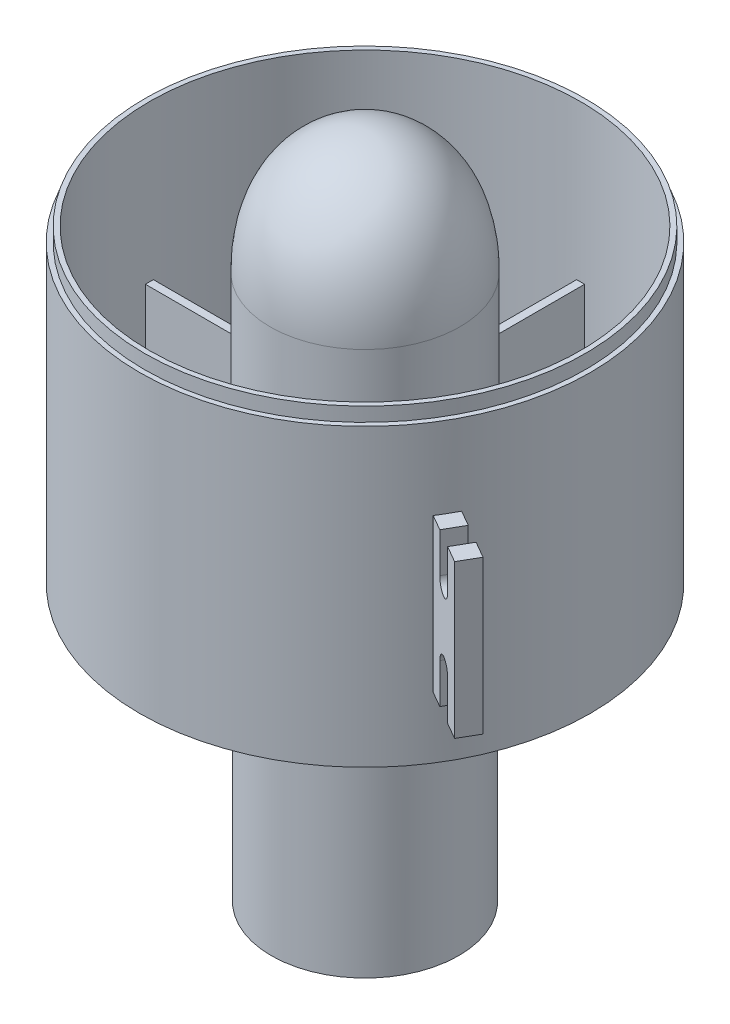
from build123d import *

# Parameters (mm, degrees)
SKETCH1_R                  = 36.8
SKETCH1_R_2                = 35.2
BOSS_EXTRUDE1_DEPTH        = 50.5
SKETCH2_R                  = 15
BOSS_EXTRUDE2_DEPTH        = 25
BOSS_EXTRUDE3_DEPTH        = 1.7
BOSS_EXTRUDE3_DEPTH_BACK   = 1.7
BOSS_EXTRUDE3_2_DEPTH      = 1.7
BOSS_EXTRUDE3_2_DEPTH_BACK = 1.7
BOSS_EXTRUDE4_REACH        = 106.402
BOSS_EXTRUDE4_END_RADIUS   = 36.8
SKETCH4_W                  = 3.4
SKETCH4_H                  = 25
CUT_EXTRUDE1_START         = -2.3
SKETCH5_R                  = 36.8
SKETCH5_R_2                = 36
CUT_EXTRUDE1_DEPTH         = 2.3
SKETCH6_R                  = 15.3
BOSS_EXTRUDE5_DEPTH        = 50
CHAMFER1_SIZE              = 5
CHAMFER1_SIZE2             = 8.660254038
SKETCH7_R                  = 15.5
BOSS_EXTRUDE6_DEPTH        = 44


with BuildPart() as part:
    # Sketch1 → Boss-Extrude1 (new body)
    with BuildSketch(Plane(origin=(0, 0, 0), x_dir=(1, 0, 0), z_dir=(0, 1, 0))):
        Circle(SKETCH1_R)
        Circle(SKETCH1_R_2, mode=Mode.SUBTRACT)
    extrude(amount=BOSS_EXTRUDE1_DEPTH)

    # Sketch2 → Boss-Extrude2 (add)
    with BuildSketch(Plane.XZ):
        with BuildLine():
            Line((15.986791423, 0.65), (35.193998068, 0.65))
            ThreePointArc((35.193998068, 0.65), (35.2, 0), (35.193998068, -0.65))
            Line((35.193998068, -0.65), (15.986791423, -0.65))
            ThreePointArc((15.986791423, -0.65), (14.78207252, -6.122934918), (11.763988032, -10.844749217))
            Line((11.763988032, -10.844749217), (25.345534099, -24.426295283))
            ThreePointArc((25.345534099, -24.426295283), (24.890158698, -24.890158698), (24.426295283, -25.345534099))
            Line((24.426295283, -25.345534099), (10.844749217, -11.763988032))
            ThreePointArc((10.844749217, -11.763988032), (6.122934918, -14.78207252), (0.65, -15.986791423))
            Line((0.65, -15.986791423), (0.65, -35.193998068))
            ThreePointArc((0.65, -35.193998068), (0, -35.2), (-0.65, -35.193998068))
            Line((-0.65, -35.193998068), (-0.65, -15.986791423))
            ThreePointArc((-0.65, -15.986791423), (-6.122934918, -14.78207252), (-10.844749217, -11.763988032))
            Line((-10.844749217, -11.763988032), (-24.426295283, -25.345534099))
            ThreePointArc((-24.426295283, -25.345534099), (-24.890158698, -24.890158698), (-25.345534099, -24.426295283))
            Line((-25.345534099, -24.426295283), (-11.763988032, -10.844749217))
            ThreePointArc((-11.763988032, -10.844749217), (-14.78207252, -6.122934918), (-15.986791423, -0.65))
            Line((-15.986791423, -0.65), (-35.193998068, -0.65))
            ThreePointArc((-35.193998068, -0.65), (-35.2, 0), (-35.193998068, 0.65))
            Line((-35.193998068, 0.65), (-15.986791423, 0.65))
            ThreePointArc((-15.986791423, 0.65), (-14.78207252, 6.122934918), (-11.763988032, 10.844749217))
            Line((-11.763988032, 10.844749217), (-25.345534099, 24.426295283))
            ThreePointArc((-25.345534099, 24.426295283), (-24.890158698, 24.890158698), (-24.426295283, 25.345534099))
            Line((-24.426295283, 25.345534099), (-10.844749217, 11.763988032))
            ThreePointArc((-10.844749217, 11.763988032), (-6.122934918, 14.78207252), (-0.65, 15.986791423))
            Line((-0.65, 15.986791423), (-0.65, 35.193998068))
            ThreePointArc((-0.65, 35.193998068), (0, 35.2), (0.65, 35.193998068))
            Line((0.65, 35.193998068), (0.65, 15.986791423))
            ThreePointArc((0.65, 15.986791423), (6.122934918, 14.78207252), (10.844749217, 11.763988032))
            Line((10.844749217, 11.763988032), (24.426295283, 25.345534099))
            ThreePointArc((24.426295283, 25.345534099), (24.890158698, 24.890158698), (25.345534099, 24.426295283))
            Line((25.345534099, 24.426295283), (11.763988032, 10.844749217))
            ThreePointArc((11.763988032, 10.844749217), (14.78207252, 6.122934918), (15.986791423, 0.65))
        make_face()
        Circle(SKETCH2_R, mode=Mode.SUBTRACT)
    extrude(amount=-BOSS_EXTRUDE2_DEPTH)

    # Boss-Extrude4: up to this cylinder (the profile starts outside it)
    boss_extrude4_end = Plane(origin=(0, 22.5, 0), z_dir=(0, -1, 0)) * Cylinder(BOSS_EXTRUDE4_END_RADIUS, 287.404, mode=Mode.PRIVATE)
    # Sketch4 → Boss-Extrude4 (add, up to the surface)
    with BuildSketch(Plane(origin=(31.870424751, 0, 18.400398309), x_dir=(-0.500000000000001, 0, 0.8660254037844382), z_dir=(-0.8660254037844382, 0, -0.500000000000001)), mode=Mode.PRIVATE) as boss_extrude4_sk1:
        with Locations((0, 22.5)):
            Rectangle(SKETCH4_W, SKETCH4_H)
    boss_extrude4_tool1 = extrude(boss_extrude4_sk1.sketch, amount=BOSS_EXTRUDE4_REACH, mode=Mode.PRIVATE) - boss_extrude4_end
    add(boss_extrude4_tool1.solids().sort_by_distance((31.870425, 22.5, 18.400398))[0])

    # Sketch5 → Cut-Extrude1 (cut)
    with BuildSketch(Plane(origin=(0, 50.5, 0), x_dir=(1, 0, 0), z_dir=(0, 1, 0)).offset(CUT_EXTRUDE1_START)):
        Circle(SKETCH5_R)
        Circle(SKETCH5_R_2, mode=Mode.SUBTRACT)
    extrude(amount=CUT_EXTRUDE1_DEPTH, mode=Mode.SUBTRACT)

    # Sketch6 → Boss-Extrude5 (add)
    with BuildSketch(Plane.XZ):
        Circle(SKETCH6_R)
    extrude(amount=BOSS_EXTRUDE5_DEPTH)

    # Chamfer1
    chamfer1_edges = [part.edges().sort_by_distance(p)[0] for p in [
        (-15.3, -50, 0),
    ]]
    chamfer1_side = [part.faces().sort_by_distance(p)[0] for p in [
        (-15.3, -25, 0),
    ]]
    chamfer(chamfer1_edges, length=CHAMFER1_SIZE, length2=CHAMFER1_SIZE2, reference=chamfer1_side[0])

    # Sketch7 → Boss-Extrude6 (add)
    with BuildSketch(Plane(origin=(0, 0, 0), x_dir=(1, 0, 0), z_dir=(0, 1, 0))):
        Circle(SKETCH7_R)
    extrude(amount=BOSS_EXTRUDE6_DEPTH)

    # Sketch8 → Revolve2 (revolve)
    with BuildSketch(Plane(origin=(0, 0, 0), x_dir=(0, -1, 0), z_dir=(-0.500000000000001, 0, 0.866025403784438))):
        with BuildLine():
            Line((-44, 15.5), (-44, 0))
            Line((-44, 0), (-64, 0))
            add(Edge.make_bspline(
                [(-44, 15.5), (-57.970648209, 15.5), (-64, 7.069745011), (-64, 0)],
                knots=[0, 0, 0, 0, 1, 1, 1, 1], degree=3))
        make_face()
    revolve(axis=Axis((0, 25, 0), (0, -1, 0)))


with BuildPart() as body_2:
    # Sketch3 → Boss-Extrude3 (new, two sides: drawn at the far end of the back side and taken through both)
    with BuildSketch(Plane(origin=(0, 0, 0), x_dir=(0, -1, 0), z_dir=(-0.500000000000001, 0, 0.866025403784438)).offset(-BOSS_EXTRUDE3_DEPTH_BACK)):
        with BuildLine():
            Line((-35, 36.800796618), (-10, 36.800796618))
            Line((-10, 36.800796618), (-10, 39.7))
            Line((-10, 39.7), (-16.5, 39.7))
            ThreePointArc((-16.5, 39.7), (-18.25, 41.45), (-16.5, 43.2))
            Line((-16.5, 43.2), (-10, 43.2))
            Line((-10, 43.2), (-10, 46.300796618))
            Line((-10, 46.300796618), (-35, 46.300796618))
            Line((-35, 46.300796618), (-35, 43.2))
            Line((-35, 43.2), (-28.5, 43.2))
            ThreePointArc((-28.5, 43.2), (-26.75, 41.45), (-28.5, 39.7))
            Line((-28.5, 39.7), (-35, 39.7))
            Line((-35, 39.7), (-35, 36.800796618))
        make_face()
    extrude(amount=BOSS_EXTRUDE3_DEPTH + BOSS_EXTRUDE3_DEPTH_BACK)


with BuildPart() as body_3:
    # Sketch3 → Boss-Extrude3 2 (new, two sides: drawn at the far end of the back side and taken through both)
    with BuildSketch(Plane(origin=(0, 0, 0), x_dir=(0, -1, 0), z_dir=(-0.500000000000001, 0, 0.866025403784438)).offset(-BOSS_EXTRUDE3_2_DEPTH_BACK)):
        with BuildLine():
            Line((-16.5, -39.7), (-10, -39.7))
            Line((-10, -39.7), (-10, -36.800796618))
            Line((-10, -36.800796618), (-35, -36.800796618))
            Line((-35, -36.800796618), (-35, -39.7))
            Line((-35, -39.7), (-28.5, -39.7))
            ThreePointArc((-28.5, -39.7), (-26.75, -41.45), (-28.5, -43.2))
            Line((-28.5, -43.2), (-35, -43.2))
            Line((-35, -43.2), (-35, -46.300796618))
            Line((-35, -46.300796618), (-10, -46.300796618))
            Line((-10, -46.300796618), (-10, -43.2))
            Line((-10, -43.2), (-16.5, -43.2))
            ThreePointArc((-16.5, -43.2), (-18.25, -41.45), (-16.5, -39.7))
        make_face()
    extrude(amount=BOSS_EXTRUDE3_2_DEPTH + BOSS_EXTRUDE3_2_DEPTH_BACK)


solid = Compound([part.part, body_2.part, body_3.part])
